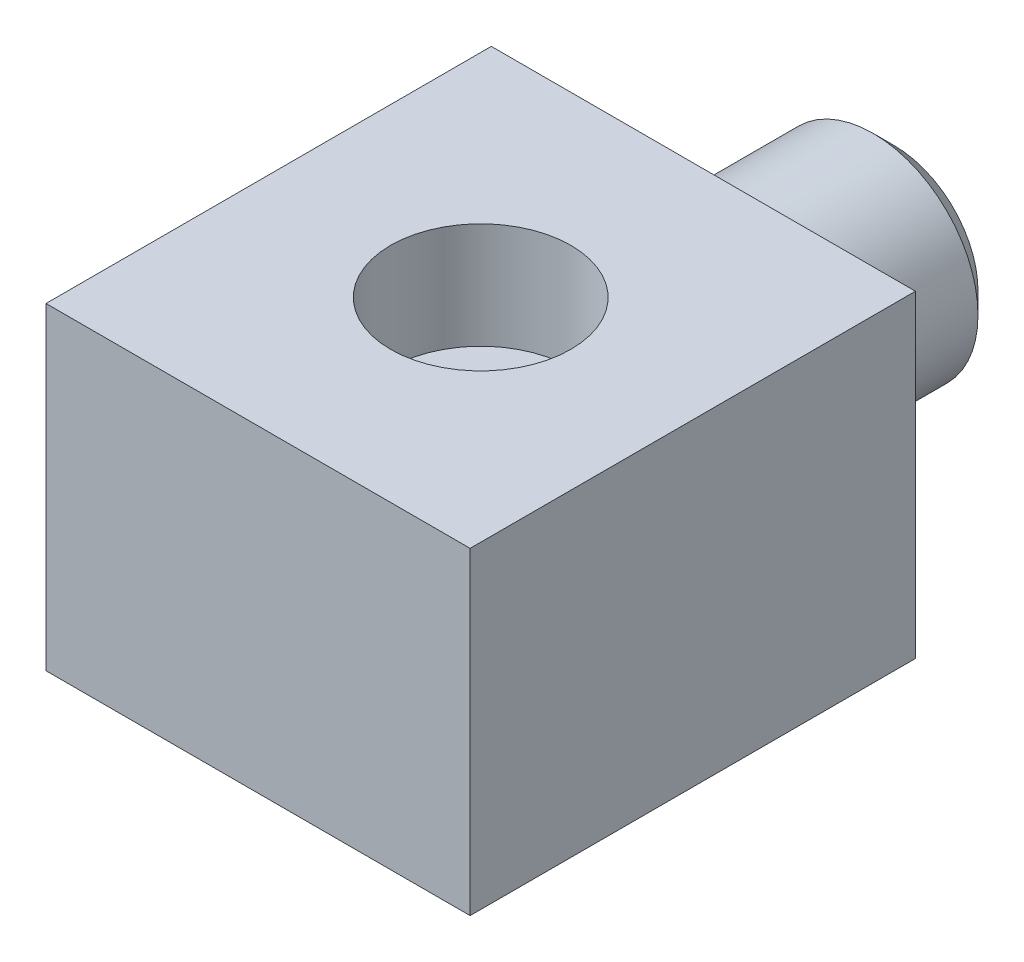
from build123d import *

# Parameters (mm, degrees)
SKETCH1_W           = 21
SKETCH1_H           = 15
BOSS_EXTRUDE1_DEPTH = 20
SKETCH2_R           = 4.95
BOSS_EXTRUDE2_DEPTH = 9
CHAMFER1_SIZE       = 1
SKETCH3_R           = 2.2
CUT_EXTRUDE1_DEPTH  = 54.824529308
SKETCH4_R           = 4.25
CUT_EXTRUDE2_DEPTH  = 5


with BuildPart() as part:
    # Sketch1 → Boss-Extrude1 (new body)
    with BuildSketch(Plane(origin=(0, 0, 0), x_dir=(0, 0, -1), z_dir=(1, 0, 0))):
        with Locations((-37.166339855, -9.630048879)):
            Rectangle(SKETCH1_W, SKETCH1_H)
    extrude(amount=BOSS_EXTRUDE1_DEPTH)

    # Sketch2 → Boss-Extrude2 (add)
    with BuildSketch(Plane(origin=(0, 0, 26.666339855), x_dir=(-1, 0, 0), z_dir=(0, 0, -1))):
        with Locations(Location((-10, -9.630048879, 0), (0, 0, 90))):
            Circle(SKETCH2_R)
    extrude(amount=BOSS_EXTRUDE2_DEPTH)

    # Chamfer1
    chamfer1_edges = [part.edges().sort_by_distance(p)[0] for p in [
        (10, -14.580048879, 17.666339855),
    ]]
    chamfer(chamfer1_edges, length=CHAMFER1_SIZE)

    # Sketch3 → Cut-Extrude1 (cut, through all)
    with BuildSketch(Plane(origin=(0, -2.130048879, 0), x_dir=(1, 0, 0), z_dir=(0, 1, 0))):
        with Locations(Location((10, -37.166339855, 0), (0, 0, 270))):
            Circle(SKETCH3_R)
    extrude(amount=-CUT_EXTRUDE1_DEPTH, mode=Mode.SUBTRACT)

    # Sketch4 → Cut-Extrude2 (cut)
    with BuildSketch(Plane(origin=(0, -2.130048879, 0), x_dir=(1, 0, 0), z_dir=(0, 1, 0))):
        with Locations(Location((10, -37.166339855, 0), (0, 0, 270))):
            Circle(SKETCH4_R)
    extrude(amount=-CUT_EXTRUDE2_DEPTH, mode=Mode.SUBTRACT)


solid = part.part
